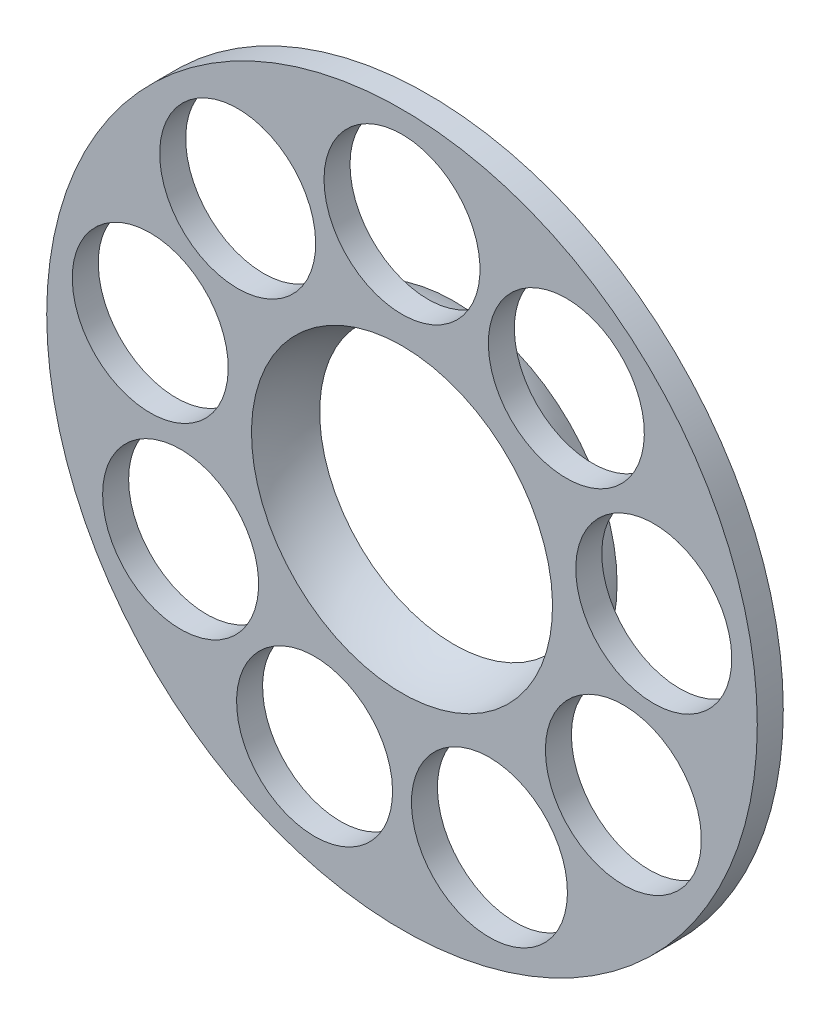
from build123d import *

# Parameters (mm, degrees)
SKETCH_5_R               = 9
CUT_EXTRUDE_1_DEPTH      = 59.060313468
PATTERN_CIRCULAR_1_COUNT = 9


with BuildPart() as part:
    # 草图4 → 旋转1 (revolve)
    with BuildSketch(Plane(origin=(0, 0, 0), x_dir=(0, 0, -1), z_dir=(1, 0, 0))):
        with BuildLine():
            Line((0, 17.370620624), (0, 41))
            Line((0, 41), (3, 41))
            Line((3, 41), (3, 19.849287907))
            ThreePointArc((3, 19.849287907), (4.519902914, 19.393505195), (6, 18.821530225))
            Line((6, 18.821530225), (6, 15.5))
            ThreePointArc((6, 15.5), (3.084663444, 16.706867601), (0, 17.370620624))
        make_face()
    revolve(axis=Axis((0, 0, 0), (0, 0, -1)))

    # 草图5 → 切除-拉伸1 (cut, through all)
    with BuildSketch(Plane(origin=(0, 0, -3), x_dir=(-1, 0, 0), z_dir=(0, 0, -1))):
        with Locations((0, 29.5)):
            Circle(SKETCH_5_R)
    cut_extrude_1 = extrude(amount=-CUT_EXTRUDE_1_DEPTH, mode=Mode.SUBTRACT)

    # 阵列(圆周)1: 切除-拉伸1 ×9 about axis
    pattern_circular_1_axis = Axis((0, 0, 0), (0, 0, 1))
    for i in range(1, PATTERN_CIRCULAR_1_COUNT):
        add(cut_extrude_1.rotate(pattern_circular_1_axis, i * 360 / PATTERN_CIRCULAR_1_COUNT), mode=Mode.SUBTRACT)


solid = part.part
